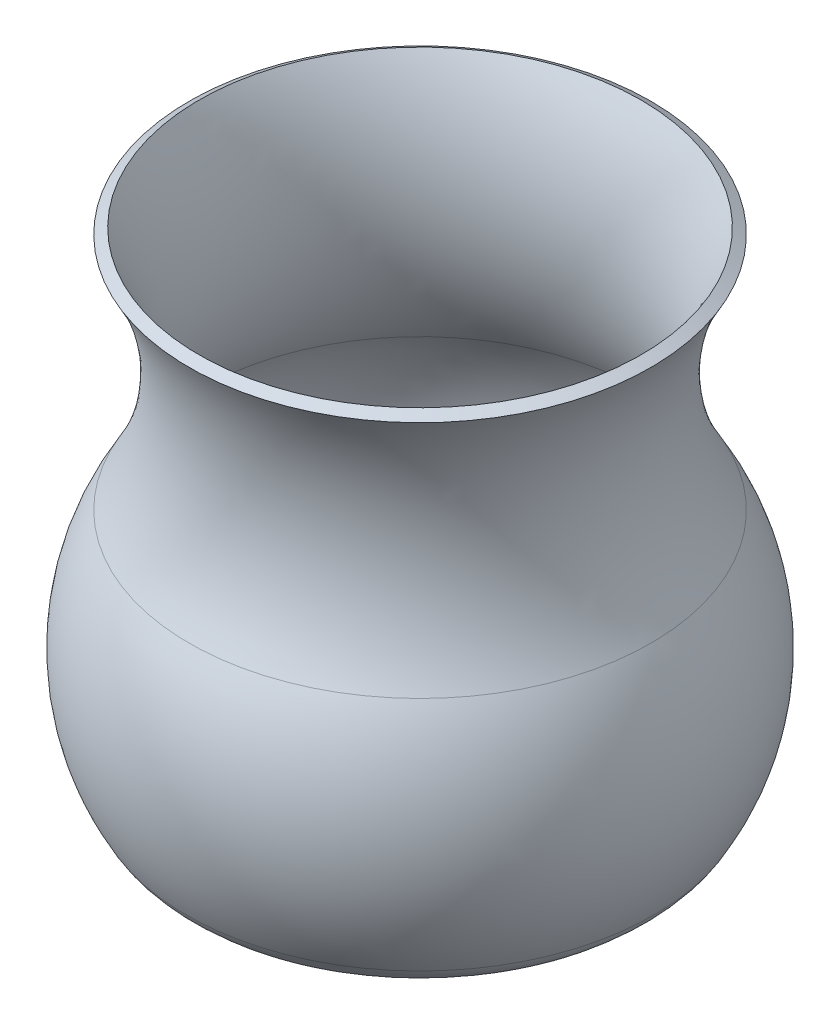
from build123d import *


with BuildPart() as part:
    # Sketch1 → Revolve-Thin1 (revolve)
    with BuildSketch(Plane.XY, mode=Mode.PRIVATE) as revolve_thin1_sk:
        with BuildLine():
            Line((0, 0), (24.287414571, 0))
            ThreePointArc((24.287414571, 0), (27.798066951, 0.943984819), (30.361861458, 3.521337181))
            ThreePointArc((30.361861458, 3.521337181), (34.326396995, 18.786592416), (30, 33.953261414))
            ThreePointArc((30, 33.953261414), (25.671482345, 49.476630707), (30, 65))
            Line((30, 65), (28.716425883, 65.776168465))
            ThreePointArc((28.716425883, 65.776168465), (24.171482345, 49.476630707), (28.716425883, 33.177092949))
            ThreePointArc((28.716425883, 33.177092949), (32.826503028, 18.768757402), (29.060194268, 4.266764928))
            ThreePointArc((29.060194268, 4.266764928), (27.045784298, 2.241702358), (24.287414571, 1.5))
            Line((24.287414571, 1.5), (0, 1.5))
            Line((0, 1.5), (0, 0))
        make_face()
    revolve(revolve_thin1_sk.sketch.rotate(Axis((0, 0, 0), (0, 1, 0)), 90), axis=Axis((0, 0, 0), (0, 1, 0)))


solid = part.part
